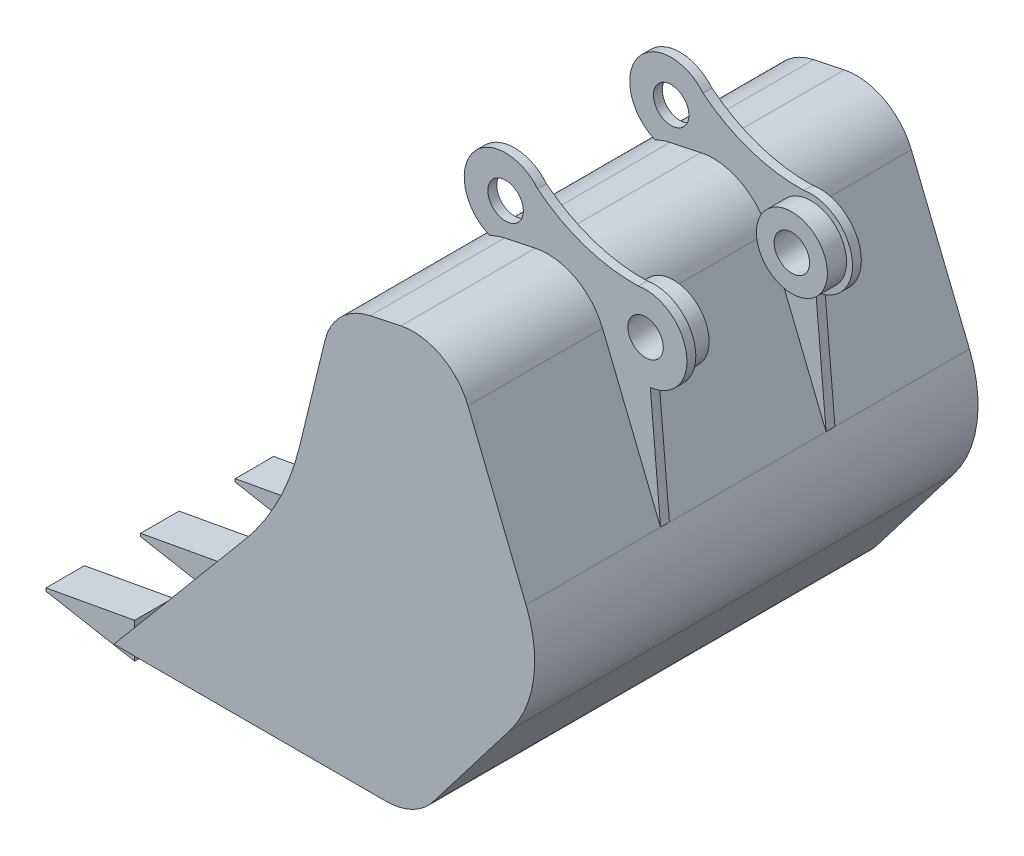
from build123d import *
from build123d.topology import SkipClean

# Parameters (mm, degrees)
BOSS_EXTRUDE4_DEPTH  = 375
BOSS_EXTRUDE5_DEPTH  = 7.5
CUT_EXTRUDE1_DEPTH   = 360
BOSS_EXTRUDE6_DEPTH  = 32.5
LPATTERN1_COUNT      = 3
LPATTERN1_PITCH      = 160
LPATTERN1_COUNT_DIR2 = 3
LPATTERN1_PITCH_DIR2 = 160
SKETCH11_R           = 30
CUT_EXTRUDE2_DEPTH   = 1263.512529339
SKETCH12_R           = 60
SKETCH12_R_2         = 30
BOSS_EXTRUDE7_DEPTH  = 32.5


with BuildPart() as part:
    # Sketch1 → Boss-Extrude4 (new, symmetric)
    with BuildSketch(Plane.XY):
        with BuildLine():
            Line((281.569977344, 264.00526259), (60.043258876, 0))
            Line((60.043258876, 0), (520.65961219, 0))
            ThreePointArc((520.65961219, 0), (564.907123778, 10.321921752), (600.02024832, 39.156845634))
            Line((600.02024832, 39.156845634), (730.44724808, 209.279019234))
            ThreePointArc((730.44724808, 209.279019234), (769.910899903, 304.081580706), (757.128519442, 405.97130652))
            Line((757.128519442, 405.97130652), (658.940406775, 648.676304078))
            ThreePointArc((658.940406775, 648.676304078), (613.16613298, 699.478789474), (545.447965883, 708.988074874))
            Line((545.447965883, 708.988074874), (493.401915404, 697.925345336))
            ThreePointArc((493.401915404, 697.925345336), (444.503904969, 671.828213907), (417.014937982, 623.698884104))
            Line((417.014937982, 623.698884104), (374.151637205, 447.112342165))
            ThreePointArc((374.151637205, 447.112342165), (338.436231819, 350.211710608), (281.569977344, 264.00526259))
        make_face()
    extrude(amount=BOSS_EXTRUDE4_DEPTH, both=True)

    # Sketch6 → Boss-Extrude5 (add, symmetric)
    with BuildSketch(Plane.XY.offset(140)):
        with BuildLine():
            Line((739.837232288, 602.21499348), (757.128519442, 405.97130652))
            Line((757.128519442, 405.97130652), (468.079651675, 688.843619215))
            ThreePointArc((468.079651675, 688.843619215), (438.909700759, 795.263431413), (549.226629435, 797.76097261))
            ThreePointArc((549.226629435, 797.76097261), (629.357941615, 754.030269249), (719.665800913, 740.692647386))
            ThreePointArc((719.665800913, 740.692647386), (801.063667795, 681.841548153), (739.837232288, 602.21499348))
        make_face()
    boss_extrude5 = extrude(amount=BOSS_EXTRUDE5_DEPTH, both=True)

    # Mirror2: Boss-Extrude5 across plane
    add(boss_extrude5.mirror(Plane.XY))

    # Sketch7 → Cut-Extrude1 (cut, symmetric)
    with BuildSketch(Plane.XY):
        with BuildLine():
            Line((60.410578327, 15), (329.990480538, 400))
            Line((329.990480538, 400), (404.359842809, 650))
            Line((404.359842809, 650), (608.375948196, 693.364961886))
            Line((608.375948196, 693.364961886), (698.639094975, 432.530508414))
            ThreePointArc((698.639094975, 432.530508414), (712.247197771, 292.899677108), (660.880251772, 162.349355884))
            Line((660.880251772, 162.349355884), (557.705122032, 15))
            Line((557.705122032, 15), (60.410578327, 15))
        make_face()
    extrude(amount=CUT_EXTRUDE1_DEPTH, both=True, mode=Mode.SUBTRACT)

    # Sketch10 → Boss-Extrude6 (add, symmetric)
    with BuildSketch(Plane.XY):
        Polygon((72.542939803, 30), (-77.392739815, 2.5), (-77.392739815, -2.5), (72.542939803, -30), (72.542939803, 0), align=None)
    boss_extrude6 = extrude(amount=BOSS_EXTRUDE6_DEPTH, both=True)

    # LPattern1: Boss-Extrude6 3 × 3
    with Locations(*[Vector(0, 0, 1) * (i * LPATTERN1_PITCH) + Vector(0, 0, -1) * (j * LPATTERN1_PITCH_DIR2) for i in range(LPATTERN1_COUNT) for j in range(LPATTERN1_COUNT_DIR2) if (i, j) != (0, 0)]):
        add(boss_extrude6)

    # Sketch11 → Cut-Extrude2 (cut, through all)
    with BuildSketch(Plane.XY.offset(147.5)):
        with Locations((495.043258876, 753.442101292)):
            Circle(SKETCH11_R)
        with Locations((731.794701004, 671.751442127)):
            Circle(SKETCH11_R)
    extrude(amount=-CUT_EXTRUDE2_DEPTH, mode=Mode.SUBTRACT)

    # Sketch12 → Boss-Extrude7 (add)
    with SkipClean():  # the faces are left unmerged after this step: merging them gives an invalid solid
        with BuildSketch(Plane(origin=(0, 0, 132.5), x_dir=(-1, 0, 0), z_dir=(0, 0, -1))):
            with Locations((-731.794701004, 671.751442127)):
                Circle(SKETCH12_R)
            with Locations((-731.794701004, 671.751442127)):
                Circle(SKETCH12_R_2, mode=Mode.SUBTRACT)
        boss_extrude7 = extrude(amount=BOSS_EXTRUDE7_DEPTH)

    # Mirror3: Boss-Extrude7 across plane
    add(boss_extrude7.mirror(Plane.XY))


solid = part.part
